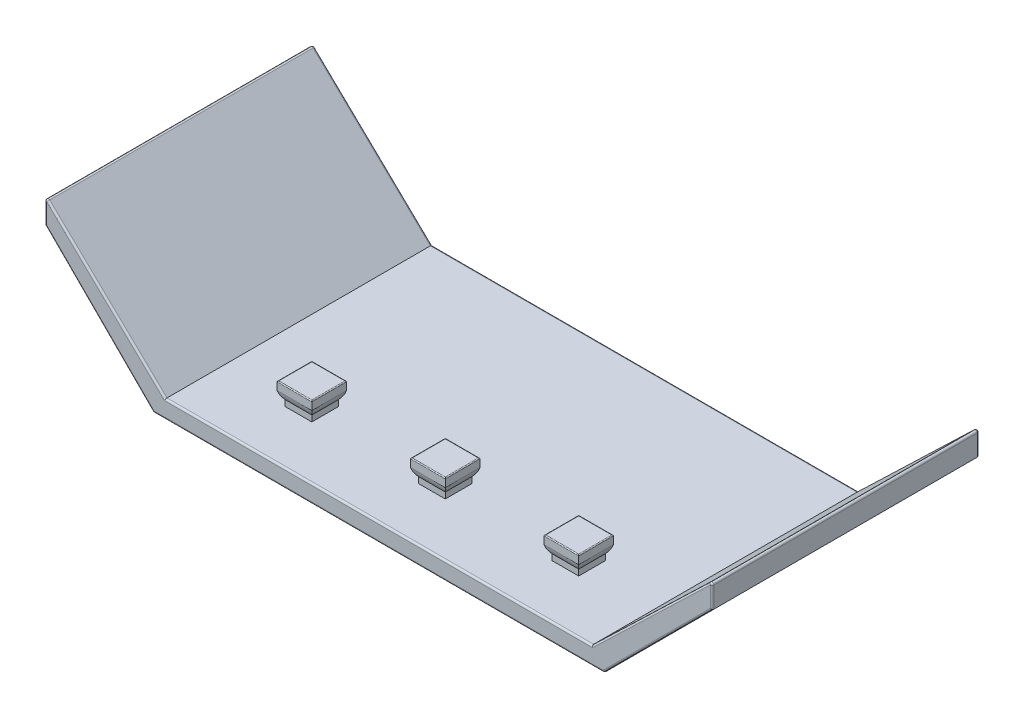
from build123d import *

# Parameters (mm, degrees)
EXTRUDE_1_DEPTH                 = 30
SKETCH_2_W                      = 3
SKETCH_2_H                      = 3
EXTRUDE_2_DEPTH                 = 1
EXTRUDE_START                   = -4
EXTRUDE_3_DEPTH                 = 5
CUT_EXTRUDE_1_REACH             = 52.312
CUT_EXTRUDE_1_DIRECTION_2_REACH = 52.312
FILLET_1_R                      = 0.1
PATTERN_LINEAR_1_COUNT          = 2
PATTERN_LINEAR_1_PITCH          = 15
PATTERN_LINEAR_1_COUNT_DIR2     = 2
PATTERN_LINEAR_1_PITCH_DIR2     = 15
FILLET_1_OF_PATTERN_LINEAR_1_R  = 0.1
FILLET_2_R                      = 0.2


with BuildPart() as part:
    # 草图1 → 凸台-拉伸1 (new body)
    with BuildSketch(Plane.XY):
        Polygon((-25.328427125, 0), (25.328427125, 0), (37.5, 12.171572875), (37.5, 15), (23.98, 2), (-23.98, 2), (-37.5, 15), (-37.5, 12.171572875), align=None)
    extrude(amount=-EXTRUDE_1_DEPTH)

    # 草图2 → 凸台-拉伸2 (add)
    with BuildSketch(Plane(origin=(0, 2, 0), x_dir=(1, 0, 0), z_dir=(0, 1, 0))):
        with Locations((0, 7.5)):
            Rectangle(SKETCH_2_W, SKETCH_2_H)
    extrude_2 = extrude(amount=EXTRUDE_2_DEPTH)

    # 草图3 → 凸台-拉伸3 (add)
    with BuildSketch(Plane.XY.offset(-6).offset(EXTRUDE_START)):
        with BuildLine():
            Line((-1.95, 4.5), (1.95, 4.5))
            Line((1.95, 4.5), (1.95, 3.555590279))
            ThreePointArc((1.95, 3.555590279), (1.780042303, 3.088161527), (1.5, 2.677124344))
            Line((1.5, 2.677124344), (-1.5, 2.677124344))
            ThreePointArc((-1.5, 2.677124344), (-1.780042303, 3.088161527), (-1.95, 3.555590279))
            Line((-1.95, 3.555590279), (-1.95, 4.5))
        make_face()
    extrude_3 = extrude(amount=EXTRUDE_3_DEPTH)

    # 草图4 → 切除-拉伸1 (cut, up to next)
    with BuildSketch(Plane(origin=(0, 0, 0), x_dir=(0, 0, -1), z_dir=(1, 0, 0)), mode=Mode.PRIVATE) as cut_extrude_1_sk1:
        with BuildLine():
            Line((10, 4.5), (9.45, 4.5))
            Line((9.45, 4.5), (9.45, 3.555590279))
            ThreePointArc((9.45, 3.555590279), (9.280042303, 3.088161527), (9, 2.677124344))
            Line((9, 2.677124344), (10, 2.677124344))
            Line((10, 2.677124344), (10, 4.5))
        make_face()
    cut_extrude_1_tool1 = extrude(cut_extrude_1_sk1.sketch, amount=-CUT_EXTRUDE_1_REACH, mode=Mode.PRIVATE) & part.part
    # 草图4 → 切除-拉伸1 (cut, up to next)
    with BuildSketch(Plane(origin=(0, 0, 0), x_dir=(0, 0, -1), z_dir=(1, 0, 0)), mode=Mode.PRIVATE) as cut_extrude_1_sk2:
        with BuildLine():
            Line((5, 4.5), (5, 2.677124344))
            Line((5, 2.677124344), (6, 2.677124344))
            ThreePointArc((6, 2.677124344), (5.719957697, 3.088161527), (5.55, 3.555590279))
            Line((5.55, 3.555590279), (5.55, 4.5))
            Line((5.55, 4.5), (5, 4.5))
        make_face()
    cut_extrude_1_tool2 = extrude(cut_extrude_1_sk2.sketch, amount=-CUT_EXTRUDE_1_REACH, mode=Mode.PRIVATE) & part.part
    cut_extrude_1_1 = cut_extrude_1_tool1.solids().sort_by_distance((0, 3.500125, -9.669375))[0]
    add(cut_extrude_1_1, mode=Mode.SUBTRACT)
    cut_extrude_1_2 = cut_extrude_1_tool2.solids().sort_by_distance((0, 3.500125, -5.330625))[0]
    add(cut_extrude_1_2, mode=Mode.SUBTRACT)
    cut_extrude_1 = cut_extrude_1_1 + cut_extrude_1_2  # 切除-拉伸1 as one shape, for the pattern or mirror that repeats it

    # 草图4 → 切除-拉伸1 direction 2 (cut, up to next)
    with BuildSketch(Plane(origin=(0, 0, 0), x_dir=(0, 0, -1), z_dir=(1, 0, 0)), mode=Mode.PRIVATE) as cut_extrude_1_direction_2_sk1:
        with BuildLine():
            Line((10, 4.5), (9.45, 4.5))
            Line((9.45, 4.5), (9.45, 3.555590279))
            ThreePointArc((9.45, 3.555590279), (9.280042303, 3.088161527), (9, 2.677124344))
            Line((9, 2.677124344), (10, 2.677124344))
            Line((10, 2.677124344), (10, 4.5))
        make_face()
    cut_extrude_1_direction_2_tool1 = extrude(cut_extrude_1_direction_2_sk1.sketch, amount=CUT_EXTRUDE_1_DIRECTION_2_REACH, mode=Mode.PRIVATE) & part.part
    # 草图4 → 切除-拉伸1 direction 2 (cut, up to next)
    with BuildSketch(Plane(origin=(0, 0, 0), x_dir=(0, 0, -1), z_dir=(1, 0, 0)), mode=Mode.PRIVATE) as cut_extrude_1_direction_2_sk2:
        with BuildLine():
            Line((5, 4.5), (5, 2.677124344))
            Line((5, 2.677124344), (6, 2.677124344))
            ThreePointArc((6, 2.677124344), (5.719957697, 3.088161527), (5.55, 3.555590279))
            Line((5.55, 3.555590279), (5.55, 4.5))
            Line((5.55, 4.5), (5, 4.5))
        make_face()
    cut_extrude_1_direction_2_tool2 = extrude(cut_extrude_1_direction_2_sk2.sketch, amount=CUT_EXTRUDE_1_DIRECTION_2_REACH, mode=Mode.PRIVATE) & part.part
    cut_extrude_1_direction_2_1 = cut_extrude_1_direction_2_tool1.solids().sort_by_distance((0, 3.500125, -9.669375))[0]
    add(cut_extrude_1_direction_2_1, mode=Mode.SUBTRACT)
    cut_extrude_1_direction_2_2 = cut_extrude_1_direction_2_tool2.solids().sort_by_distance((0, 3.500125, -5.330625))[0]
    add(cut_extrude_1_direction_2_2, mode=Mode.SUBTRACT)
    cut_extrude_1_direction_2 = cut_extrude_1_direction_2_1 + cut_extrude_1_direction_2_2  # 切除-拉伸1 direction 2 as one shape, for the pattern or mirror that repeats it

    # 圆角1
    fillet_1_edges = [part.edges().sort_by_distance(p)[0] for p in [
        (1.95, 4.5, -7.5),
        (-1.95, 4.5, -7.5),
        (0, 4.5, -9.45),
        (0, 4.5, -5.55),
    ]]
    fillet(fillet_1_edges, radius=FILLET_1_R)

    # 阵列(线性)1: 凸台-拉伸2, 凸台-拉伸3, 切除-拉伸1, 切除-拉伸1 direction 2 2 × 2
    with Locations(*[Vector(1, 0, 0) * (i * PATTERN_LINEAR_1_PITCH) + Vector(-1, 0, 0) * (j * PATTERN_LINEAR_1_PITCH_DIR2) for i in range(PATTERN_LINEAR_1_COUNT) for j in range(PATTERN_LINEAR_1_COUNT_DIR2) if (i, j) != (0, 0)]):
        add(extrude_2)
        add(extrude_3)
        add(cut_extrude_1, mode=Mode.SUBTRACT)
        add(cut_extrude_1_direction_2, mode=Mode.SUBTRACT)

    # 圆角1 of 阵列(线性)1
    fillet_1_of_pattern_linear_1_edges = [part.edges().sort_by_distance(p)[0] for p in [
        (-13.05, 4.5, -7.5),
        (-16.95, 4.5, -7.5),
        (-15, 4.5, -9.45),
        (-15, 4.5, -5.55),
        (16.95, 4.5, -7.5),
        (13.05, 4.5, -7.5),
        (15, 4.5, -9.45),
        (15, 4.5, -5.55),
        (1.95, 4.5, -7.5),
        (-1.95, 4.5, -7.5),
        (0, 4.5, -9.45),
        (0, 4.5, -5.55),
    ]]
    fillet(fillet_1_of_pattern_linear_1_edges, radius=FILLET_1_OF_PATTERN_LINEAR_1_R)

    # 圆角2
    fillet_2_edges = [part.edges().sort_by_distance(p)[0] for p in [
        (0, 0, -30),
        (-31.414213562, 6.085786438, 0),
        (-37.5, 13.585786438, 0),
        (31.414213562, 6.085786438, -30),
        (-37.5, 15, -15),
        (37.5, 15, -15),
        (25.328427125, 0, -15),
        (-25.328427125, 0, -15),
        (37.5, 13.585786438, -30),
        (30.74, 8.5, -30),
        (0, 2, -30),
        (-30.74, 8.5, -30),
        (-37.5, 13.585786438, -30),
        (-31.414213562, 6.085786438, -30),
        (-30.74, 8.5, 0),
        (0, 2, 0),
        (30.74, 8.5, 0),
        (37.5, 13.585786438, 0),
        (31.414213562, 6.085786438, 0),
        (0, 0, 0),
    ]]
    fillet(fillet_2_edges, radius=FILLET_2_R)


solid = part.part
